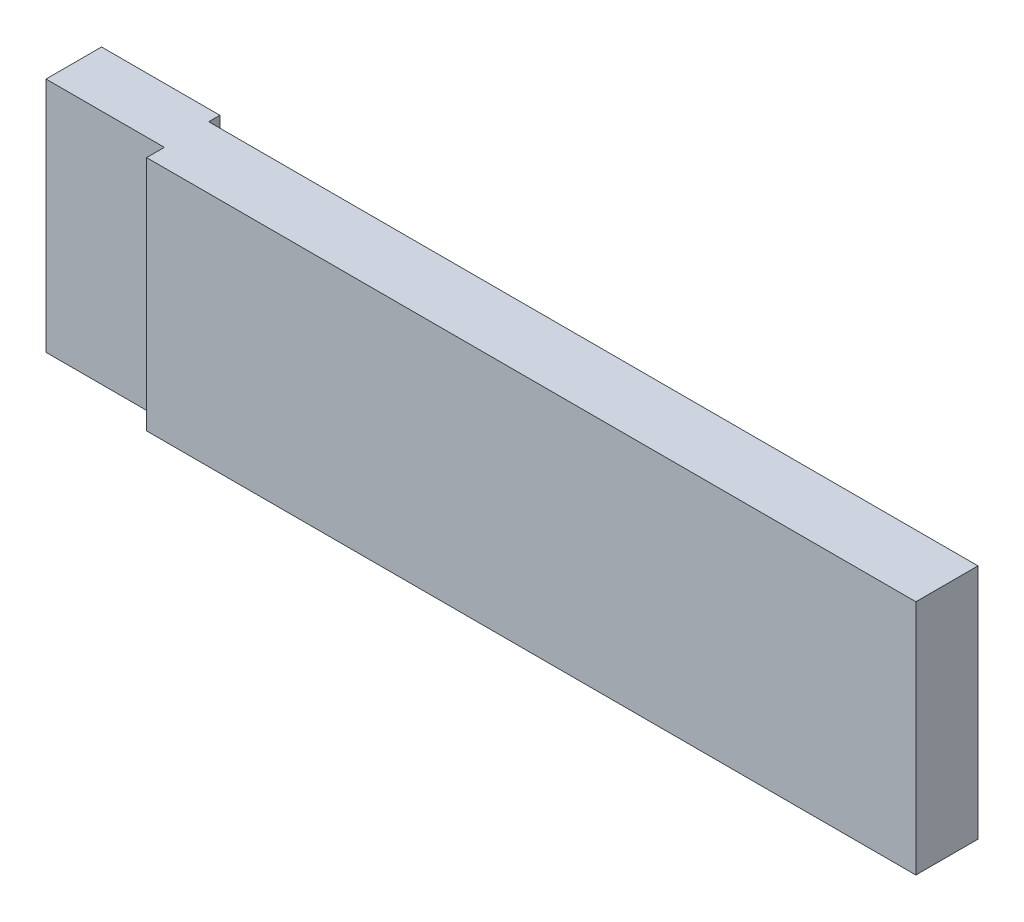
from build123d import *

# Parameters (mm, degrees)
SCHIZZO1_W                   = 15
SCHIZZO1_H                   = 4
ESTRUSIONE_ESTRUSIONE1_DEPTH = 1.5
SCHIZZO2_W                   = 13
SCHIZZO2_H                   = 4
ESTRUSIONE_ESTRUSIONE2_DEPTH = 0.3
TAGLIO_ESTRUSIONE1_DEPTH     = 4


with BuildPart() as part:
    # Schizzo1 → Estrusione-Estrusione1 (new body)
    with BuildSketch(Plane.XY):
        Rectangle(SCHIZZO1_W, SCHIZZO1_H)
    extrude(amount=-ESTRUSIONE_ESTRUSIONE1_DEPTH)

    # Schizzo2 → Estrusione-Estrusione2 (add)
    with BuildSketch(Plane.XY):
        with Locations((1, 0)):
            Rectangle(SCHIZZO2_W, SCHIZZO2_H)
    extrude(amount=ESTRUSIONE_ESTRUSIONE2_DEPTH)

    # Schizzo3 → Taglio-Estrusione1 (cut)
    with BuildSketch(Plane(origin=(0, 2, 0), x_dir=(1, 0, 0), z_dir=(0, 1, 0))):
        Polygon((-7.5, 1.5), (7.5, 1.5), (7.5, 0.75), (-5.5, 0.75), (-5.5, 0.938702512), (-7.5, 0.938702512), (-7.5, 0.75), (-7.660914318, 0.75), (-7.660914318, 1.501079849), align=None)
    extrude(amount=-TAGLIO_ESTRUSIONE1_DEPTH, mode=Mode.SUBTRACT)


solid = part.part
